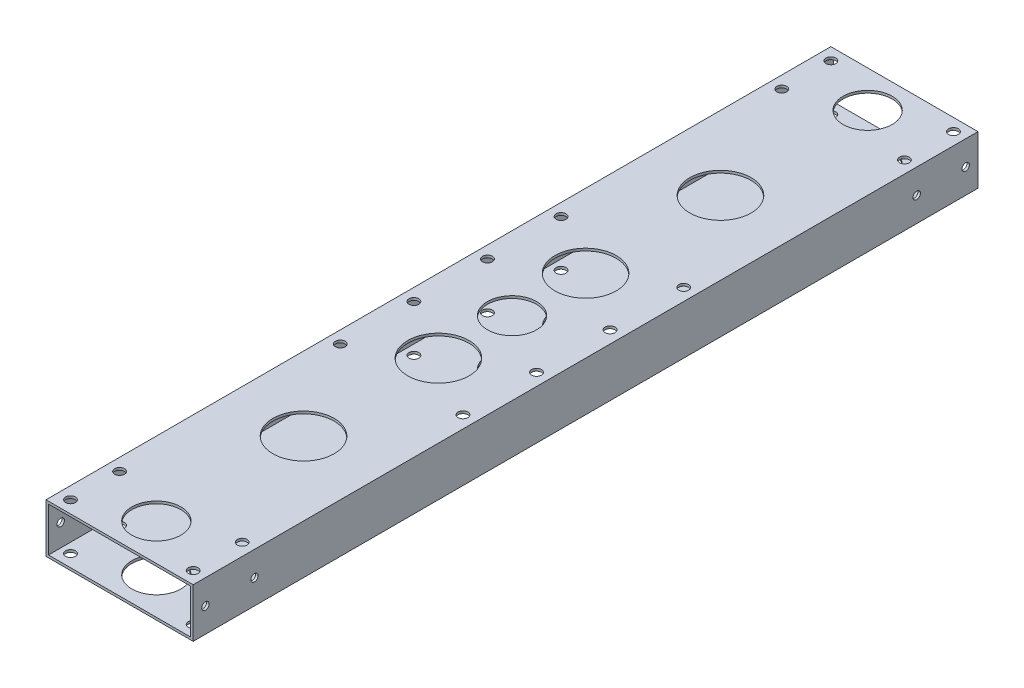
from build123d import *

# Parameters (mm, degrees)
SKETCH_1_W          = 60
SKETCH_1_H          = 20
SKETCH_1_W_2        = 58
SKETCH_1_H_2        = 18
EXTRUDE_1_DEPTH     = 320
SKETCH_2_R          = 2
CUT_EXTRUDE_1_DEPTH = 327.190128606
SKETCH_4_R          = 1.5
CUT_EXTRUDE_2_DEPTH = 327.190128606
SKETCH_5_R          = 10
SKETCH_5_R_2        = 12.5
CUT_EXTRUDE_3_DEPTH = 327.190128606


with BuildPart() as part:
    # 草图1 → 拉伸-薄壁1 (new body)
    with BuildSketch(Plane.XY):
        with Locations((30, 10)):
            Rectangle(SKETCH_1_W, SKETCH_1_H)
        with Locations((30, 10)):
            Rectangle(SKETCH_1_W_2, SKETCH_1_H_2, mode=Mode.SUBTRACT)
    extrude(amount=EXTRUDE_1_DEPTH)

    # 草图2 → 切除-拉伸1 (cut, through all)
    with BuildSketch(Plane(origin=(0, 20, 0), x_dir=(1, 0, 0), z_dir=(0, 1, 0))):
        with Locations(Location((5, -145, 0), (0, 0, 270))):
            Circle(SKETCH_2_R)
        with Locations(Location((5, -175, 0), (0, 0, 270))):
            Circle(SKETCH_2_R)
        with Locations(Location((55, -175, 0), (0, 0, 90))):
            Circle(SKETCH_2_R)
        with Locations(Location((55, -145, 0), (0, 0, 90))):
            Circle(SKETCH_2_R)
        with Locations(Location((5, -115, 0), (0, 0, 270))):
            Circle(SKETCH_2_R)
        with Locations(Location((5, -205, 0), (0, 0, 90))):
            Circle(SKETCH_2_R)
        with Locations(Location((55, -205, 0), (0, 0, 270))):
            Circle(SKETCH_2_R)
        with Locations(Location((55, -115, 0), (0, 0, 90))):
            Circle(SKETCH_2_R)
        with Locations(Location((5, -5, 0), (0, 0, 270))):
            Circle(SKETCH_2_R)
        with Locations(Location((55, -5, 0), (0, 0, 270))):
            Circle(SKETCH_2_R)
        with Locations(Location((55, -25, 0), (0, 0, 270))):
            Circle(SKETCH_2_R)
        with Locations(Location((5, -25, 0), (0, 0, 270))):
            Circle(SKETCH_2_R)
        with Locations(Location((5, -295, 0), (0, 0, 90))):
            Circle(SKETCH_2_R)
        with Locations(Location((55, -295, 0), (0, 0, 90))):
            Circle(SKETCH_2_R)
        with Locations(Location((55, -315, 0), (0, 0, 90))):
            Circle(SKETCH_2_R)
        with Locations(Location((5, -315, 0), (0, 0, 90))):
            Circle(SKETCH_2_R)
    extrude(amount=-CUT_EXTRUDE_1_DEPTH, mode=Mode.SUBTRACT)

    # 草图4 → 切除-拉伸2 (cut, through all)
    with BuildSketch(Plane(origin=(60, 0, 0), x_dir=(0, 0, -1), z_dir=(1, 0, 0))):
        with Locations((-315, 10)):
            Circle(SKETCH_4_R)
        with Locations((-295, 10)):
            Circle(SKETCH_4_R)
        with Locations(Location((-25, 10, 0), (0, 0, 180))):
            Circle(SKETCH_4_R)
        with Locations(Location((-5, 10, 0), (0, 0, 180))):
            Circle(SKETCH_4_R)
    extrude(amount=-CUT_EXTRUDE_2_DEPTH, mode=Mode.SUBTRACT)

    # 草图5 → 切除-拉伸3 (cut, through all)
    with BuildSketch(Plane(origin=(0, 20, 0), x_dir=(1, 0, 0), z_dir=(0, 1, 0))):
        with Locations(Location((30, -160, 0), (0, 0, 270))):
            Circle(SKETCH_5_R)
        with Locations(Location((30, -130, 0), (0, 0, 270))):
            Circle(SKETCH_5_R_2)
        with Locations(Location((30, -190, 0), (0, 0, 90))):
            Circle(SKETCH_5_R_2)
        with Locations(Location((30, -75, 0), (0, 0, 270))):
            Circle(SKETCH_5_R_2)
        with Locations(Location((30, -15, 0), (0, 0, 270))):
            Circle(SKETCH_5_R)
        with Locations(Location((30, -305, 0), (0, 0, 90))):
            Circle(SKETCH_5_R)
        with Locations(Location((30, -245, 0), (0, 0, 90))):
            Circle(SKETCH_5_R_2)
    extrude(amount=-CUT_EXTRUDE_3_DEPTH, mode=Mode.SUBTRACT)


solid = part.part
